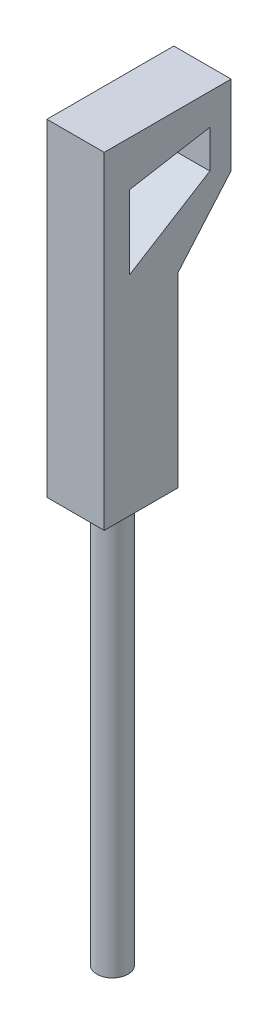
from build123d import *

# Parameters (mm, degrees)
BOSS_EXTRUDE1_DEPTH     = 70
CUT_EXTRUDE1_DEPTH      = 435.655035632
CUT_EXTRUDE1_DEPTH_BACK = 435.655035632
SKETCH4_R               = 19.05
BOSS_EXTRUDE2_DEPTH     = 500


with BuildPart() as part:
    # Sketch2 → Boss-Extrude1 (new body)
    with BuildSketch(Plane(origin=(0, 0, 0), x_dir=(0, 0, -1), z_dir=(1, 0, 0))):
        Polygon((0, 0), (155, 0), (155, -97.047904462), (90, -172.424894861), (90, -400), (0, -400), align=None)
    extrude(amount=BOSS_EXTRUDE1_DEPTH)

    # Sketch3 → Cut-Extrude1 (cut, two sides: drawn at the far end of the back side and taken through both)
    with BuildSketch(Plane(origin=(70, 0, 0), x_dir=(0, 0, -1), z_dir=(1, 0, 0)).offset(-CUT_EXTRUDE1_DEPTH_BACK)):
        Polygon((31, -55), (129, -38), (129, -84.32322248), (31, -145), align=None)
    extrude(amount=CUT_EXTRUDE1_DEPTH + CUT_EXTRUDE1_DEPTH_BACK, mode=Mode.SUBTRACT)

    # Sketch4 → Boss-Extrude2 (add)
    with BuildSketch(Plane.XZ.offset(400)):
        with Locations(Location((35, -45, 0), (0, 0, 270))):
            Circle(SKETCH4_R)
    extrude(amount=BOSS_EXTRUDE2_DEPTH)


solid = part.part
